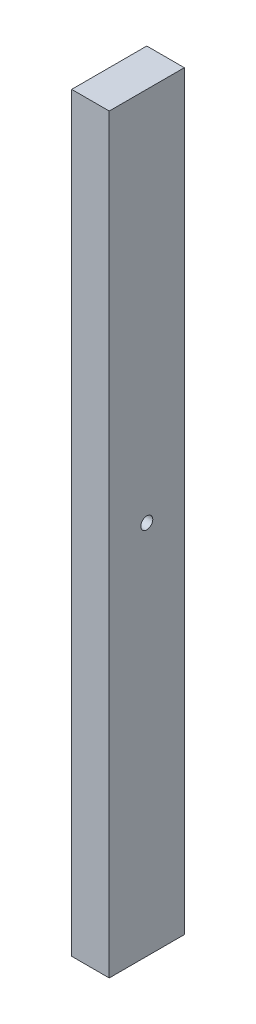
from build123d import *

# Parameters (mm, degrees)
SKETCH_1_W          = 25
SKETCH_1_H          = 50
EXTRUDE_1_DEPTH     = 550
SKETCH_2_R          = 4
CUT_EXTRUDE_1_DEPTH = 10
CUT_EXTRUDE_START   = -10
SKETCH_3_R          = 4
CUT_EXTRUDE_2_DEPTH = 10
SKETCH_4_W          = 25
SKETCH_4_H          = 50
CUT_EXTRUDE_3_DEPTH = 50
SKETCH_5_R          = 4
CUT_EXTRUDE_4_DEPTH = 51


with BuildPart() as part:
    # Эскиз1 → Бобышка-Вытянуть1 (new body)
    with BuildSketch(Plane(origin=(0, 0, 0), x_dir=(1, 0, 0), z_dir=(0, 1, 0))):
        Rectangle(SKETCH_1_W, SKETCH_1_H)
    extrude(amount=EXTRUDE_1_DEPTH)

    # Эскиз2 → Вырез-Вытянуть1 (cut)
    with BuildSketch(Plane(origin=(0, 550, 0), x_dir=(1, 0, 0), z_dir=(0, 1, 0))):
        with Locations(Location((0, 0, 0), (0, 0, 270))):
            Circle(SKETCH_2_R)
    extrude(amount=-CUT_EXTRUDE_1_DEPTH, mode=Mode.SUBTRACT)

    # Эскиз3 → Вырез-Вытянуть2 (cut)
    with BuildSketch(Plane.XZ.offset(CUT_EXTRUDE_START)):
        with Locations(Location((0, 0, 0), (0, 0, 90))):
            Circle(SKETCH_3_R)
    extrude(amount=CUT_EXTRUDE_2_DEPTH, mode=Mode.SUBTRACT)

    # Эскиз4 → Вырез-Вытянуть3 (cut)
    with BuildSketch(Plane(origin=(0, 550, 0), x_dir=(1, 0, 0), z_dir=(0, 1, 0))):
        Rectangle(SKETCH_4_W, SKETCH_4_H)
    extrude(amount=-CUT_EXTRUDE_3_DEPTH, mode=Mode.SUBTRACT)

    # Эскиз5 → Вырез-Вытянуть4 (cut)
    with BuildSketch(Plane(origin=(12.5, 0, 0), x_dir=(0, 0, -1), z_dir=(1, 0, 0))):
        with Locations((0, 250)):
            Circle(SKETCH_5_R)
    extrude(amount=-CUT_EXTRUDE_4_DEPTH, mode=Mode.SUBTRACT)


solid = part.part
